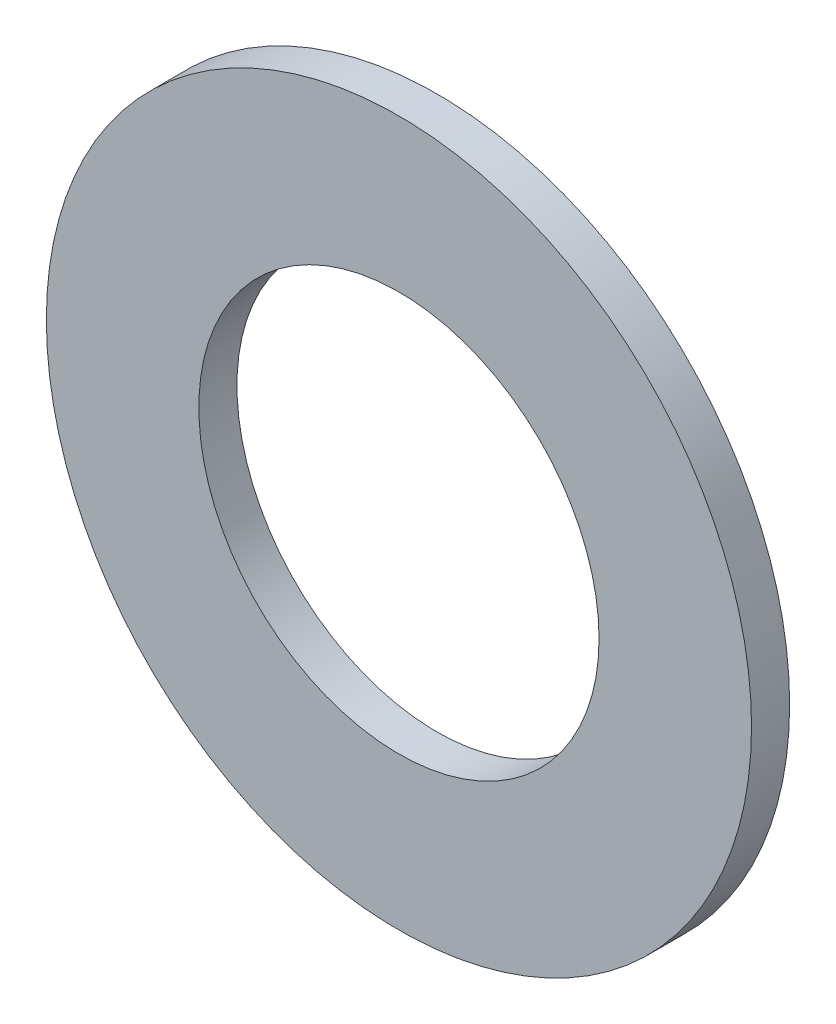
from build123d import *

# Parameters (mm, degrees)
SKETCH1_R           = 3.7
SKETCH1_R_2         = 2.1
BOSS_EXTRUDE1_DEPTH = 0.4


with BuildPart() as part:
    # Sketch1 → Boss-Extrude1 (new body)
    with BuildSketch(Plane.XY):
        Circle(SKETCH1_R)
        Circle(SKETCH1_R_2, mode=Mode.SUBTRACT)
    extrude(amount=BOSS_EXTRUDE1_DEPTH)


solid = part.part
